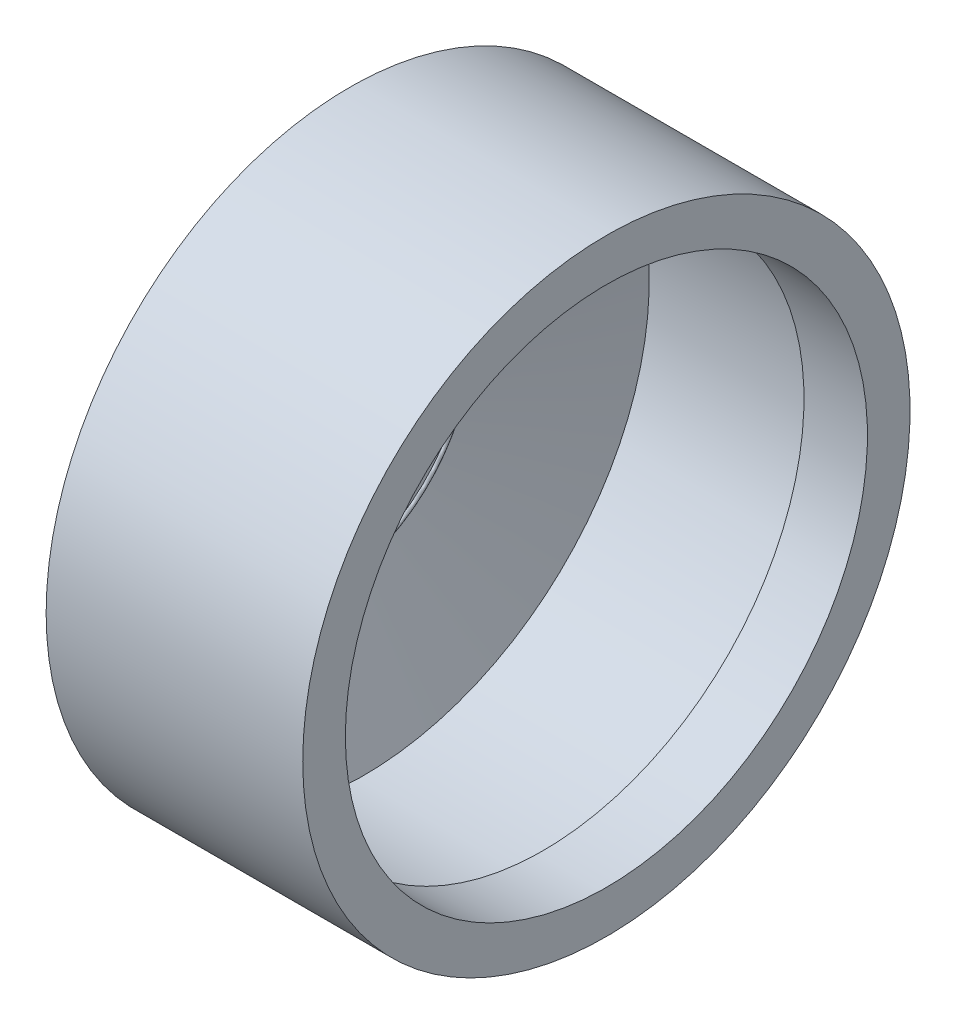
from build123d import *

# Parameters (mm, degrees)
ESBO_O1_R = 0.125


with BuildPart() as part:
    # Esboço1 → Revolução1 (revolve)
    with BuildSketch(Plane.XY, mode=Mode.PRIVATE) as revolu_o1_sk:
        with Locations((1, 7.868347502)):
            Circle(ESBO_O1_R)
        Polygon((1, 7.868347502), (1, 3.5), (0.25, 3.5), (0.25, 8), (0, 8), (2.344555434, 16.75), (16.5, 16.75), (16.5, 14.4), (13, 14.4), (13, 15.75), (3.111882422, 15.75), align=None)
    revolve(revolu_o1_sk.sketch.rotate(Axis((0, 0, 0), (1, 0, 0)), 90), axis=Axis((0, 0, 0), (1, 0, 0)))


solid = part.part
